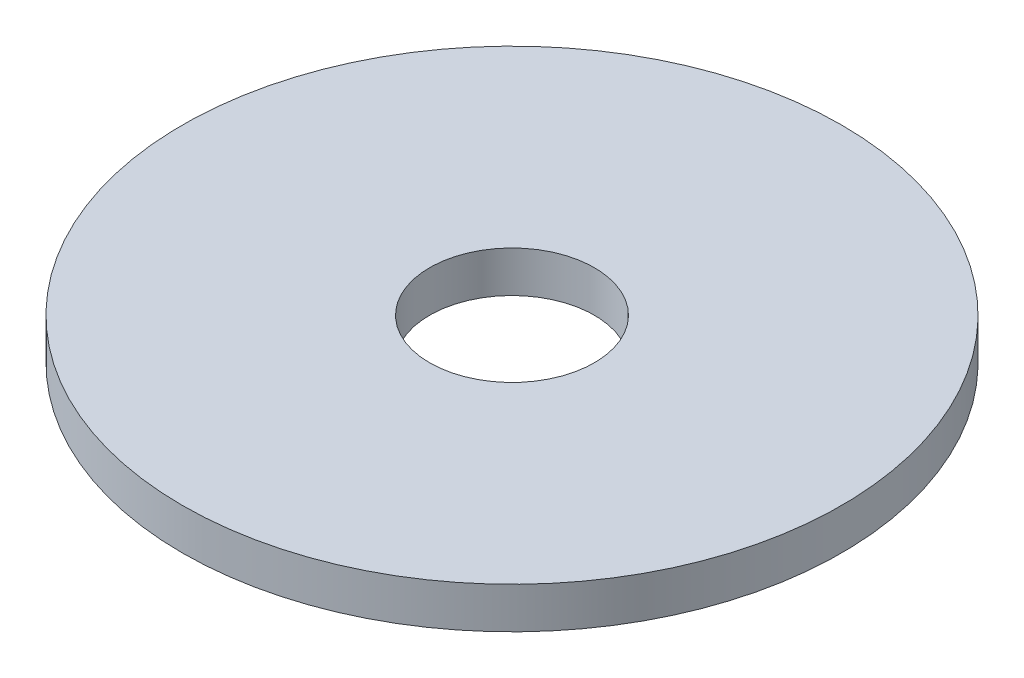
from build123d import *

# Parameters (mm, degrees)
SKETCH_1_R      = 4
SKETCH_1_R_2    = 1
EXTRUDE_1_DEPTH = 0.5


with BuildPart() as part:
    # 草图1 → 凸台-拉伸1 (new body)
    with BuildSketch(Plane(origin=(0, 0, 0), x_dir=(1, 0, 0), z_dir=(0, 1, 0))):
        with Locations(Location((0, 0, 0), (0, 0, 270))):
            Circle(SKETCH_1_R)
        with Locations(Location((0, 0, 0), (0, 0, 270))):
            Circle(SKETCH_1_R_2, mode=Mode.SUBTRACT)
    extrude(amount=EXTRUDE_1_DEPTH)


solid = part.part
